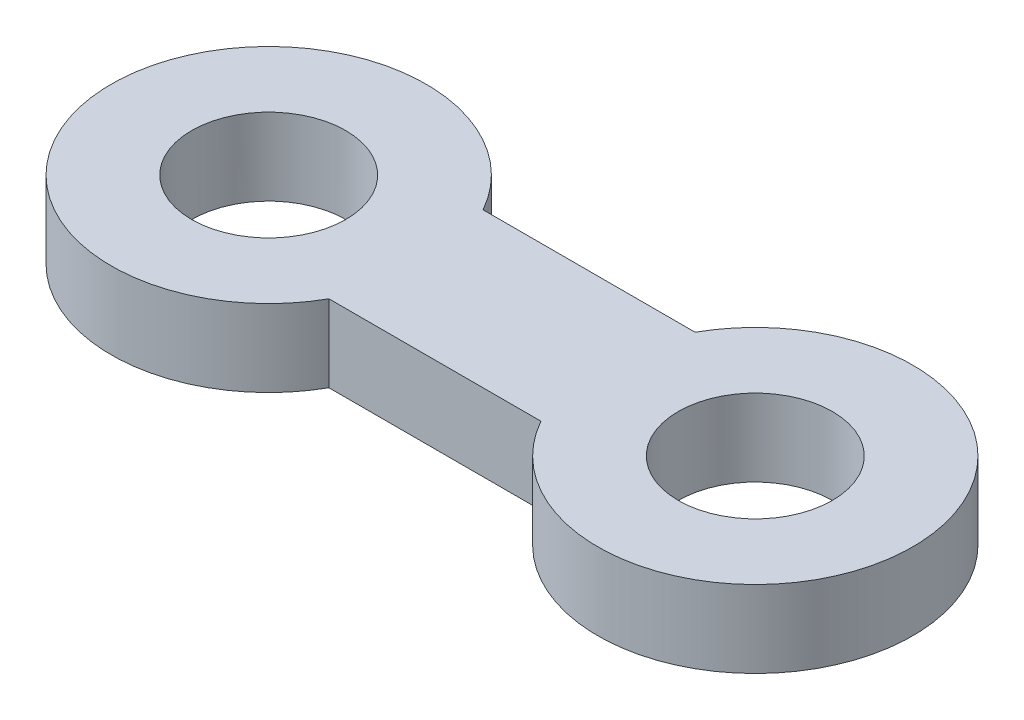
from build123d import *

# Parameters (mm, degrees)
SKETCH4_R           = 40.863144044
SKETCH4_W           = 55
SKETCH4_H           = 40
BOSS_EXTRUDE1_DEPTH = 20
CUT_EXTRUDE1_REACH  = 115.513
SKETCH6_R           = 20


with BuildPart() as part:
    # Sketch4 → Boss-Extrude1 (new body)
    with BuildSketch(Plane(origin=(0, 0, 0), x_dir=(1, 0, 0), z_dir=(0, 1, 0))):
        with Locations((-63.134204652, 0)):
            Circle(SKETCH4_R)
        with Locations((63.134204652, 0)):
            Circle(SKETCH4_R)
        Rectangle(SKETCH4_W, SKETCH4_H)
    extrude(amount=BOSS_EXTRUDE1_DEPTH)

    # Sketch6 → Cut-Extrude1 (cut, up to next)
    with BuildSketch(Plane.XZ, mode=Mode.PRIVATE) as cut_extrude1_sk1:
        with Locations(Location((-63.134204652, 0, 0), (0, 0, 270))):
            Circle(SKETCH6_R)
    cut_extrude1_tool1 = extrude(cut_extrude1_sk1.sketch, amount=-CUT_EXTRUDE1_REACH, mode=Mode.PRIVATE) & part.part
    # Sketch6 → Cut-Extrude1 (cut, up to next)
    with BuildSketch(Plane.XZ, mode=Mode.PRIVATE) as cut_extrude1_sk2:
        with Locations(Location((63.134204652, 0, 0), (0, 0, 270))):
            Circle(SKETCH6_R)
    cut_extrude1_tool2 = extrude(cut_extrude1_sk2.sketch, amount=-CUT_EXTRUDE1_REACH, mode=Mode.PRIVATE) & part.part
    add(cut_extrude1_tool1.solids().sort_by_distance((-63.134205, 0, 0))[0], mode=Mode.SUBTRACT)
    add(cut_extrude1_tool2.solids().sort_by_distance((63.134205, 0, 0))[0], mode=Mode.SUBTRACT)


solid = part.part
